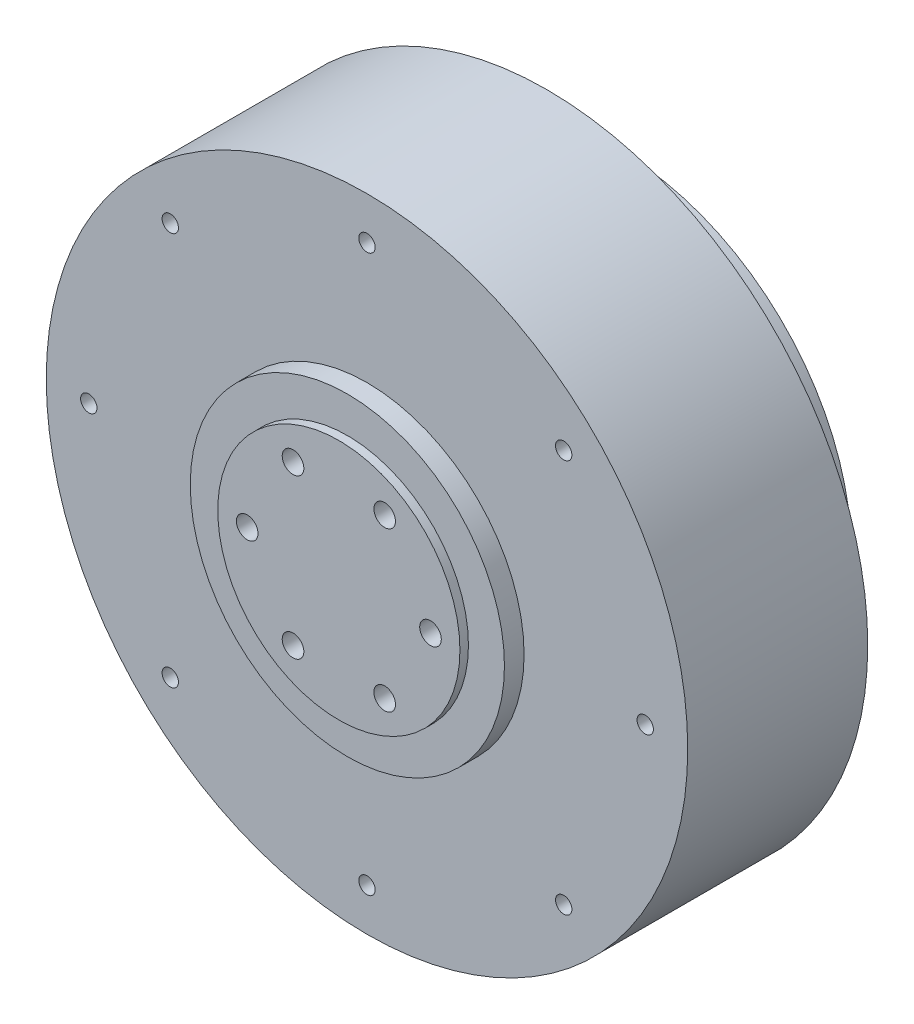
from build123d import *

# Parameters (mm, degrees)
M4_TAPPED_HOLE1_D     = 3.3
M4_TAPPED_HOLE1_DEPTH = 5
M4_TAPPED_HOLE1_TIP   = 0.991420021
M3_TAPPED_HOLE1_D     = 2.5
M3_TAPPED_HOLE1_DEPTH = 3
M3_TAPPED_HOLE1_TIP   = 0.751075774
M3_TAPPED_HOLE2_D     = 2.5
M3_TAPPED_HOLE2_DEPTH = 3
M3_TAPPED_HOLE2_TIP   = 0.751075774


with BuildPart() as part:
    # Sketch1 → Revolve1 (revolve)
    with BuildSketch(Plane(origin=(0, 0, 0), x_dir=(0, 0, -1), z_dir=(1, 0, 0)), mode=Mode.PRIVATE) as revolve1_sk:
        Polygon((0, 0), (0, 18.5), (1.3, 18.5), (1.3, 24), (4.3, 24), (4.3, 49), (31.8, 49), (31.8, 35.5), (42.8, 35.5), (42.8, 0), align=None)
    revolve(revolve1_sk.sketch.rotate(Axis((0, 0, 42.770748728), (0, 0, -1)), 90), axis=Axis((0, 0, 42.770748728), (0, 0, -1)))

    # M4 Tapped Hole1
    with Locations(Plane.XY):
        with Locations((-14, 0), (-7, 12.124355653), (7, 12.124355653), (14, 0), (7, -12.124355653), (-7, -12.124355653)):
            Hole(M4_TAPPED_HOLE1_D / 2, depth=M4_TAPPED_HOLE1_DEPTH)
            with Locations((0, 0, -(M4_TAPPED_HOLE1_DEPTH + M4_TAPPED_HOLE1_TIP / 2))):  # 118° drill point
                Cone(0, M4_TAPPED_HOLE1_D / 2, M4_TAPPED_HOLE1_TIP, mode=Mode.SUBTRACT)

    # M3 Tapped Hole1
    with Locations(Plane.XY.offset(-4.3)):
        with Locations((-42.5, 0), (-30.0520382, 30.0520382), (0, 42.5), (30.0520382, 30.0520382), (42.5, 0), (30.0520382, -30.0520382), (0, -42.5), (-30.0520382, -30.0520382)):
            Hole(M3_TAPPED_HOLE1_D / 2, depth=M3_TAPPED_HOLE1_DEPTH)
            with Locations((0, 0, -(M3_TAPPED_HOLE1_DEPTH + M3_TAPPED_HOLE1_TIP / 2))):  # 118° drill point
                Cone(0, M3_TAPPED_HOLE1_D / 2, M3_TAPPED_HOLE1_TIP, mode=Mode.SUBTRACT)

    # M3 Tapped Hole2
    with Locations(Plane(origin=(0, 0, -31.8), x_dir=(-1, 0, 0), z_dir=(0, 0, -1))):
        with Locations((-42.5, 0), (-30.0520382, 30.0520382), (0, 42.5), (30.0520382, 30.0520382), (42.5, 0), (30.0520382, -30.0520382), (0, -42.5), (-30.0520382, -30.0520382)):
            Hole(M3_TAPPED_HOLE2_D / 2, depth=M3_TAPPED_HOLE2_DEPTH)
            with Locations((0, 0, -(M3_TAPPED_HOLE2_DEPTH + M3_TAPPED_HOLE2_TIP / 2))):  # 118° drill point
                Cone(0, M3_TAPPED_HOLE2_D / 2, M3_TAPPED_HOLE2_TIP, mode=Mode.SUBTRACT)


solid = part.part
